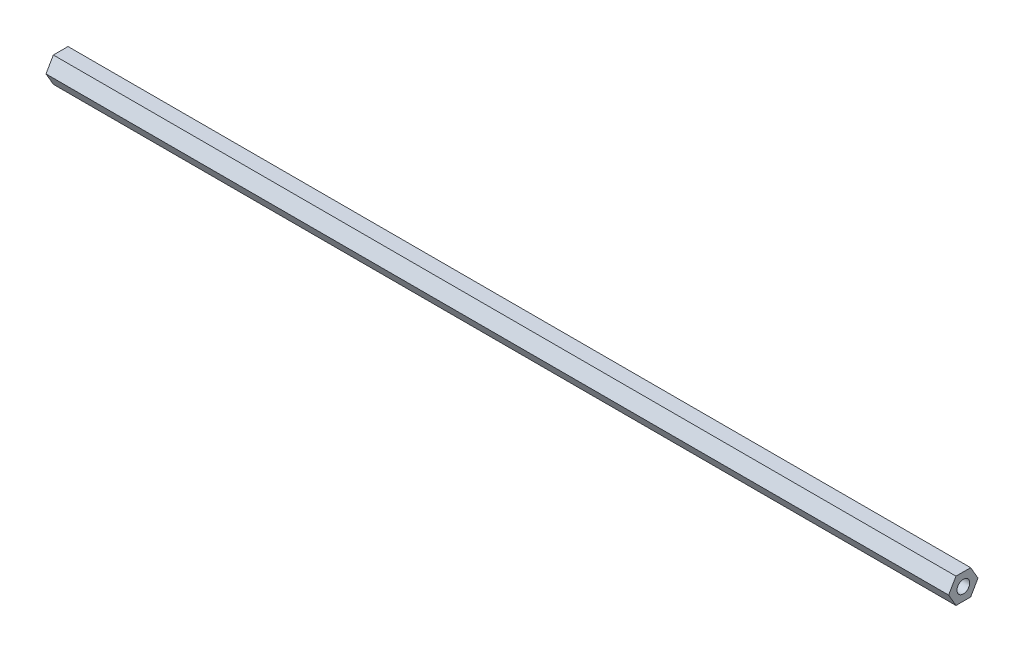
from build123d import *

# Parameters (mm, degrees)
SKETCH1_R           = 3.175
BOSS_EXTRUDE1_DEPTH = 225.425


with BuildPart() as part:
    # Sketch1 → Boss-Extrude1 (new, symmetric)
    with BuildSketch(Plane(origin=(0, 0, 0), x_dir=(0, 0, -1), z_dir=(1, 0, 0))):
        Polygon((-3.666174209, 6.35), (-7.332348419, 0), (-3.666174209, -6.35), (3.666174209, -6.35), (7.332348419, 0), (3.666174209, 6.35), align=None)
        with Locations(Location((0, 0, 0), (0, 0, 180))):
            Circle(SKETCH1_R, mode=Mode.SUBTRACT)
    extrude(amount=BOSS_EXTRUDE1_DEPTH, both=True)


solid = part.part
